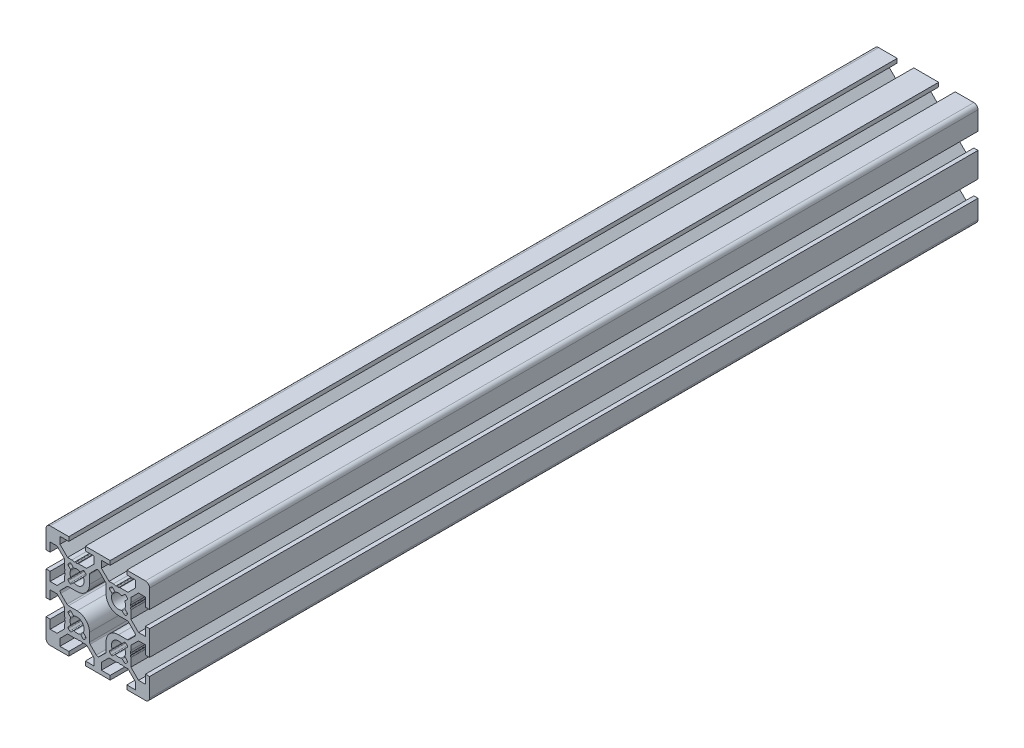
from build123d import *

# Parameters (mm, degrees)
BOSS_EXTRUDE1_DEPTH = 400
CUT_EXTRUDE1_DEPTH  = 402.559460105
CUT_EXTRUDE2_DEPTH  = 402.559460105
CUT_EXTRUDE3_DEPTH  = 402.559460105
CUT_EXTRUDE4_DEPTH  = 402.559460105


with BuildPart() as part:
    # Sketch1 → Boss-Extrude1 (new body)
    with BuildSketch(Plane.XY):
        with BuildLine():
            Line((-25, 23), (-25, 14))
            Line((-25, 14), (-23, 14))
            Line((-23, 14), (-23, 18.25))
            Line((-23, 18.25), (-19.664213562, 18.25))
            Line((-19.664213562, 18.25), (-16, 14.585786438))
            Line((-16, 14.585786438), (-16, 10.653589838))
            ThreePointArc((-16, 10.653589838), (-15.982962913, 10.524180316), (-15.933012702, 10.403589838))
            Line((-15.933012702, 10.403589838), (-15.7, 10))
            Line((-15.7, 10), (-15.933012702, 9.596410162))
            ThreePointArc((-15.933012702, 9.596410162), (-16, 9.346410162), (-15.933012702, 9.096410162))
            Line((-15.933012702, 9.096410162), (-15.750976592, 8.781114371))
            Line((-15.750976592, 8.781114371), (-16, 7.5))
            Line((-16, 7.5), (-16, 5.414213562))
            Line((-16, 5.414213562), (-19.664213562, 1.75))
            Line((-19.664213562, 1.75), (-23, 1.75))
            Line((-23, 1.75), (-23, 6))
            Line((-23, 6), (-25, 6))
            Line((-25, 6), (-25, -6))
            Line((-25, -6), (-23, -6))
            Line((-23, -6), (-23, -1.75))
            Line((-23, -1.75), (-19.664213562, -1.75))
            Line((-19.664213562, -1.75), (-16, -5.414213562))
            Line((-16, -5.414213562), (-16, -9.346410162))
            ThreePointArc((-16, -9.346410162), (-15.982962913, -9.475819684), (-15.933012702, -9.596410162))
            Line((-15.933012702, -9.596410162), (-15.7, -10))
            Line((-15.7, -10), (-15.933012702, -10.403589838))
            ThreePointArc((-15.933012702, -10.403589838), (-16, -10.653589838), (-15.933012702, -10.903589838))
            Line((-15.933012702, -10.903589838), (-15.750976592, -11.218885629))
            Line((-15.750976592, -11.218885629), (-16, -12.5))
            Line((-16, -12.5), (-16, -14.585786438))
            Line((-16, -14.585786438), (-19.664213562, -18.25))
            Line((-19.664213562, -18.25), (-23, -18.25))
            Line((-23, -18.25), (-23, -14))
            Line((-23, -14), (-25, -14))
            Line((-25, -14), (-25, -23))
            ThreePointArc((-25, -23), (-24.414213562, -24.414213562), (-23, -25))
            Line((-23, -25), (-14, -25))
            Line((-14, -25), (-14, -23))
            Line((-14, -23), (-18.25, -23))
            Line((-18.25, -23), (-18.25, -19.664213562))
            Line((-18.25, -19.664213562), (-14.585786438, -16))
            Line((-14.585786438, -16), (-10.653589838, -16))
            ThreePointArc((-10.653589838, -16), (-10.524180316, -15.982962913), (-10.403589838, -15.933012702))
            Line((-10.403589838, -15.933012702), (-10, -15.7))
            Line((-10, -15.7), (-9.596410162, -15.933012702))
            ThreePointArc((-9.596410162, -15.933012702), (-9.346410162, -16), (-9.096410162, -15.933012702))
            Line((-9.096410162, -15.933012702), (-8.781114371, -15.750976592))
            Line((-8.781114371, -15.750976592), (-7.5, -16))
            Line((-7.5, -16), (-5.414213562, -16))
            Line((-5.414213562, -16), (-1.75, -19.664213562))
            Line((-1.75, -19.664213562), (-1.75, -23))
            Line((-1.75, -23), (-6, -23))
            Line((-6, -23), (-6, -25))
            Line((-6, -25), (6, -25))
            Line((6, -25), (6, -23))
            Line((6, -23), (1.75, -23))
            Line((1.75, -23), (1.75, -19.664213562))
            Line((1.75, -19.664213562), (5.414213562, -16))
            Line((5.414213562, -16), (9.346410162, -16))
            ThreePointArc((9.346410162, -16), (9.475819684, -15.982962913), (9.596410162, -15.933012702))
            Line((9.596410162, -15.933012702), (10, -15.7))
            Line((10, -15.7), (10.403589838, -15.933012702))
            ThreePointArc((10.403589838, -15.933012702), (10.653589838, -16), (10.903589838, -15.933012702))
            Line((10.903589838, -15.933012702), (11.218885629, -15.750976592))
            Line((11.218885629, -15.750976592), (12.5, -16))
            Line((12.5, -16), (14.585786438, -16))
            Line((14.585786438, -16), (18.25, -19.664213562))
            Line((18.25, -19.664213562), (18.25, -23))
            Line((18.25, -23), (14, -23))
            Line((14, -23), (14, -25))
            Line((14, -25), (23, -25))
            ThreePointArc((23, -25), (24.414213562, -24.414213562), (25, -23))
            Line((25, -23), (25, -14))
            Line((25, -14), (23, -14))
            Line((23, -14), (23, -18.25))
            Line((23, -18.25), (19.664213562, -18.25))
            Line((19.664213562, -18.25), (16, -14.585786438))
            Line((16, -14.585786438), (16, -10.653589838))
            ThreePointArc((16, -10.653589838), (15.982962913, -10.524180316), (15.933012702, -10.403589838))
            Line((15.933012702, -10.403589838), (15.7, -10))
            Line((15.7, -10), (15.933012702, -9.596410162))
            ThreePointArc((15.933012702, -9.596410162), (16, -9.346410162), (15.933012702, -9.096410162))
            Line((15.933012702, -9.096410162), (15.750976592, -8.781114371))
            Line((15.750976592, -8.781114371), (16, -7.5))
            Line((16, -7.5), (16, -5.414213562))
            Line((16, -5.414213562), (19.664213562, -1.75))
            Line((19.664213562, -1.75), (23, -1.75))
            Line((23, -1.75), (23, -6))
            Line((23, -6), (25, -6))
            Line((25, -6), (25, 6))
            Line((25, 6), (23, 6))
            Line((23, 6), (23, 1.75))
            Line((23, 1.75), (19.664213562, 1.75))
            Line((19.664213562, 1.75), (16, 5.414213562))
            Line((16, 5.414213562), (16, 9.346410162))
            ThreePointArc((16, 9.346410162), (15.982962913, 9.475819684), (15.933012702, 9.596410162))
            Line((15.933012702, 9.596410162), (15.7, 10))
            Line((15.7, 10), (15.933012702, 10.403589838))
            ThreePointArc((15.933012702, 10.403589838), (16, 10.653589838), (15.933012702, 10.903589838))
            Line((15.933012702, 10.903589838), (15.750976592, 11.218885629))
            Line((15.750976592, 11.218885629), (16, 12.5))
            Line((16, 12.5), (16, 14.585786438))
            Line((16, 14.585786438), (19.664213562, 18.25))
            Line((19.664213562, 18.25), (23, 18.25))
            Line((23, 18.25), (23, 14))
            Line((23, 14), (25, 14))
            Line((25, 14), (25, 23))
            ThreePointArc((25, 23), (24.414213562, 24.414213562), (23, 25))
            Line((23, 25), (14, 25))
            Line((14, 25), (14, 23))
            Line((14, 23), (18.25, 23))
            Line((18.25, 23), (18.25, 19.664213562))
            Line((18.25, 19.664213562), (14.585786438, 16))
            Line((14.585786438, 16), (10.653589838, 16))
            ThreePointArc((10.653589838, 16), (10.524180316, 15.982962913), (10.403589838, 15.933012702))
            Line((10.403589838, 15.933012702), (10, 15.7))
            Line((10, 15.7), (9.596410162, 15.933012702))
            ThreePointArc((9.596410162, 15.933012702), (9.346410162, 16), (9.096410162, 15.933012702))
            Line((9.096410162, 15.933012702), (8.781114371, 15.750976592))
            Line((8.781114371, 15.750976592), (7.5, 16))
            Line((7.5, 16), (5.414213562, 16))
            Line((5.414213562, 16), (1.75, 19.664213562))
            Line((1.75, 19.664213562), (1.75, 23))
            Line((1.75, 23), (6, 23))
            Line((6, 23), (6, 25))
            Line((6, 25), (-6, 25))
            Line((-6, 25), (-6, 23))
            Line((-6, 23), (-1.75, 23))
            Line((-1.75, 23), (-1.75, 19.664213562))
            Line((-1.75, 19.664213562), (-5.414213562, 16))
            Line((-5.414213562, 16), (-9.346410162, 16))
            ThreePointArc((-9.346410162, 16), (-9.475819684, 15.982962913), (-9.596410162, 15.933012702))
            Line((-9.596410162, 15.933012702), (-10, 15.7))
            Line((-10, 15.7), (-10.403589838, 15.933012702))
            ThreePointArc((-10.403589838, 15.933012702), (-10.653589838, 16), (-10.903589838, 15.933012702))
            Line((-10.903589838, 15.933012702), (-11.218885629, 15.750976592))
            Line((-11.218885629, 15.750976592), (-12.5, 16))
            Line((-12.5, 16), (-14.585786438, 16))
            Line((-14.585786438, 16), (-18.25, 19.664213562))
            Line((-18.25, 19.664213562), (-18.25, 23))
            Line((-18.25, 23), (-14, 23))
            Line((-14, 23), (-14, 25))
            Line((-14, 25), (-23, 25))
            ThreePointArc((-23, 25), (-24.414213562, 24.414213562), (-25, 23))
        make_face()
        with BuildLine():
            Line((-17.878679656, -0.707106781), (-14.878679656, -3.707106781))
            ThreePointArc((-14.878679656, -3.707106781), (-14.554256308, -3.923879533), (-14.171572875, -4))
            Line((-14.171572875, -4), (-10, -4))
            ThreePointArc((-10, -4), (-5.757359313, -5.757359313), (-4, -10))
            Line((-4, -10), (-4, -14.171572875))
            ThreePointArc((-4, -14.171572875), (-3.923879533, -14.554256308), (-3.707106781, -14.878679656))
            Line((-3.707106781, -14.878679656), (-0.707106781, -17.878679656))
            ThreePointArc((-0.707106781, -17.878679656), (0, -18.171572875), (0.707106781, -17.878679656))
            Line((0.707106781, -17.878679656), (3.707106781, -14.878679656))
            ThreePointArc((3.707106781, -14.878679656), (3.923879533, -14.554256308), (4, -14.171572875))
            Line((4, -14.171572875), (4, -10))
            ThreePointArc((4, -10), (5.757359313, -5.757359313), (10, -4))
            Line((10, -4), (14.171572875, -4))
            ThreePointArc((14.171572875, -4), (14.554256308, -3.923879533), (14.878679656, -3.707106781))
            Line((14.878679656, -3.707106781), (17.878679656, -0.707106781))
            ThreePointArc((17.878679656, -0.707106781), (18.171572875, 0), (17.878679656, 0.707106781))
            Line((17.878679656, 0.707106781), (14.878679656, 3.707106781))
            ThreePointArc((14.878679656, 3.707106781), (14.554256308, 3.923879533), (14.171572875, 4))
            Line((14.171572875, 4), (10, 4))
            ThreePointArc((10, 4), (5.757359313, 5.757359313), (4, 10))
            Line((4, 10), (4, 14.171572875))
            ThreePointArc((4, 14.171572875), (3.923879533, 14.554256308), (3.707106781, 14.878679656))
            Line((3.707106781, 14.878679656), (0.707106781, 17.878679656))
            ThreePointArc((0.707106781, 17.878679656), (0, 18.171572875), (-0.707106781, 17.878679656))
            Line((-0.707106781, 17.878679656), (-3.707106781, 14.878679656))
            ThreePointArc((-3.707106781, 14.878679656), (-3.923879533, 14.554256308), (-4, 14.171572875))
            Line((-4, 14.171572875), (-4, 10))
            ThreePointArc((-4, 10), (-5.757359313, 5.757359313), (-10, 4))
            Line((-10, 4), (-14.171572875, 4))
            ThreePointArc((-14.171572875, 4), (-14.554256308, 3.923879533), (-14.878679656, 3.707106781))
            Line((-14.878679656, 3.707106781), (-17.878679656, 0.707106781))
            ThreePointArc((-17.878679656, 0.707106781), (-18.171572875, 0), (-17.878679656, -0.707106781))
        make_face(mode=Mode.SUBTRACT)
    extrude(amount=-BOSS_EXTRUDE1_DEPTH)

    # Sketch2 → Cut-Extrude1 (cut, through all)
    with BuildSketch(Plane.XY):
        with BuildLine():
            Line((-14.242640687, 12.828427125), (-13.205105981, 11.790892418))
            ThreePointArc((-13.205105981, 11.790892418), (-13.095045749, 11.583064884), (-13.120796199, 11.349307631))
            ThreePointArc((-13.120796199, 11.349307631), (-13.4, 10.000000021), (-13.120796216, 8.650692407))
            ThreePointArc((-13.120796216, 8.650692407), (-13.095045745, 8.416935137), (-13.205105981, 8.209107582))
            Line((-13.205105981, 8.209107582), (-14.242640687, 7.171572875))
            ThreePointArc((-14.242640687, 7.171572875), (-14.389087297, 6.818019485), (-14.242640687, 6.464466094))
            Line((-14.242640687, 6.464466094), (-13.535533906, 5.757359313))
            ThreePointArc((-13.535533906, 5.757359313), (-13.181980515, 5.610912703), (-12.828427125, 5.757359313))
            Line((-12.828427125, 5.757359313), (-11.790892418, 6.794894019))
            ThreePointArc((-11.790892418, 6.794894019), (-11.583064884, 6.904954251), (-11.349307631, 6.879203801))
            ThreePointArc((-11.349307631, 6.879203801), (-7.595836944, 7.595836944), (-6.879203801, 11.349307631))
            ThreePointArc((-6.879203801, 11.349307631), (-6.904954251, 11.583064884), (-6.794894019, 11.790892418))
            Line((-6.794894019, 11.790892418), (-5.757359313, 12.828427125))
            ThreePointArc((-5.757359313, 12.828427125), (-5.610912703, 13.181980515), (-5.757359313, 13.535533906))
            Line((-5.757359313, 13.535533906), (-6.464466094, 14.242640687))
            ThreePointArc((-6.464466094, 14.242640687), (-6.818019485, 14.389087297), (-7.171572875, 14.242640687))
            Line((-7.171572875, 14.242640687), (-8.209107582, 13.205105981))
            ThreePointArc((-8.209107582, 13.205105981), (-8.416935116, 13.095045749), (-8.650692369, 13.120796199))
            ThreePointArc((-8.650692369, 13.120796199), (-9.999999979, 13.4), (-11.349307593, 13.120796216))
            ThreePointArc((-11.349307593, 13.120796216), (-11.583064863, 13.095045745), (-11.790892418, 13.205105981))
            Line((-11.790892418, 13.205105981), (-12.828427125, 14.242640687))
            ThreePointArc((-12.828427125, 14.242640687), (-13.181980515, 14.389087297), (-13.535533906, 14.242640687))
            Line((-13.535533906, 14.242640687), (-14.242640687, 13.535533906))
            ThreePointArc((-14.242640687, 13.535533906), (-14.389087297, 13.181980515), (-14.242640687, 12.828427125))
        make_face()
    extrude(amount=-CUT_EXTRUDE1_DEPTH, mode=Mode.SUBTRACT)

    # Sketch3 → Cut-Extrude2 (cut, through all)
    with BuildSketch(Plane.XY):
        with BuildLine():
            Line((-12.828427125, -14.242640687), (-11.790892418, -13.205105981))
            ThreePointArc((-11.790892418, -13.205105981), (-11.583064884, -13.095045749), (-11.349307631, -13.120796199))
            ThreePointArc((-11.349307631, -13.120796199), (-10.000000021, -13.4), (-8.650692407, -13.120796216))
            ThreePointArc((-8.650692407, -13.120796216), (-8.416935137, -13.095045745), (-8.209107582, -13.205105981))
            Line((-8.209107582, -13.205105981), (-7.171572875, -14.242640687))
            ThreePointArc((-7.171572875, -14.242640687), (-6.818019485, -14.389087297), (-6.464466094, -14.242640687))
            Line((-6.464466094, -14.242640687), (-5.757359313, -13.535533906))
            ThreePointArc((-5.757359313, -13.535533906), (-5.610912703, -13.181980515), (-5.757359313, -12.828427125))
            Line((-5.757359313, -12.828427125), (-6.794894019, -11.790892418))
            ThreePointArc((-6.794894019, -11.790892418), (-6.904954251, -11.583064884), (-6.879203801, -11.349307631))
            ThreePointArc((-6.879203801, -11.349307631), (-7.595836944, -7.595836944), (-11.349307631, -6.879203801))
            ThreePointArc((-11.349307631, -6.879203801), (-11.583064884, -6.904954251), (-11.790892418, -6.794894019))
            Line((-11.790892418, -6.794894019), (-12.828427125, -5.757359313))
            ThreePointArc((-12.828427125, -5.757359313), (-13.181980515, -5.610912703), (-13.535533906, -5.757359313))
            Line((-13.535533906, -5.757359313), (-14.242640687, -6.464466094))
            ThreePointArc((-14.242640687, -6.464466094), (-14.389087297, -6.818019485), (-14.242640687, -7.171572875))
            Line((-14.242640687, -7.171572875), (-13.205105981, -8.209107582))
            ThreePointArc((-13.205105981, -8.209107582), (-13.095045749, -8.416935116), (-13.120796199, -8.650692369))
            ThreePointArc((-13.120796199, -8.650692369), (-13.4, -9.999999979), (-13.120796216, -11.349307593))
            ThreePointArc((-13.120796216, -11.349307593), (-13.095045745, -11.583064863), (-13.205105981, -11.790892418))
            Line((-13.205105981, -11.790892418), (-14.242640687, -12.828427125))
            ThreePointArc((-14.242640687, -12.828427125), (-14.389087297, -13.181980515), (-14.242640687, -13.535533906))
            Line((-14.242640687, -13.535533906), (-13.535533906, -14.242640687))
            ThreePointArc((-13.535533906, -14.242640687), (-13.181980515, -14.389087297), (-12.828427125, -14.242640687))
        make_face()
    extrude(amount=-CUT_EXTRUDE2_DEPTH, mode=Mode.SUBTRACT)

    # Sketch4 → Cut-Extrude3 (cut, through all)
    with BuildSketch(Plane.XY):
        with BuildLine():
            Line((14.242640687, -12.828427125), (13.205105981, -11.790892418))
            ThreePointArc((13.205105981, -11.790892418), (13.095045749, -11.583064884), (13.120796199, -11.349307631))
            ThreePointArc((13.120796199, -11.349307631), (13.4, -10.000000021), (13.120796216, -8.650692407))
            ThreePointArc((13.120796216, -8.650692407), (13.095045745, -8.416935137), (13.205105981, -8.209107582))
            Line((13.205105981, -8.209107582), (14.242640687, -7.171572875))
            ThreePointArc((14.242640687, -7.171572875), (14.389087297, -6.818019485), (14.242640687, -6.464466094))
            Line((14.242640687, -6.464466094), (13.535533906, -5.757359313))
            ThreePointArc((13.535533906, -5.757359313), (13.181980515, -5.610912703), (12.828427125, -5.757359313))
            Line((12.828427125, -5.757359313), (11.790892418, -6.794894019))
            ThreePointArc((11.790892418, -6.794894019), (11.583064884, -6.904954251), (11.349307631, -6.879203801))
            ThreePointArc((11.349307631, -6.879203801), (7.595836944, -7.595836944), (6.879203801, -11.349307631))
            ThreePointArc((6.879203801, -11.349307631), (6.904954251, -11.583064884), (6.794894019, -11.790892418))
            Line((6.794894019, -11.790892418), (5.757359313, -12.828427125))
            ThreePointArc((5.757359313, -12.828427125), (5.610912703, -13.181980515), (5.757359313, -13.535533906))
            Line((5.757359313, -13.535533906), (6.464466094, -14.242640687))
            ThreePointArc((6.464466094, -14.242640687), (6.818019485, -14.389087297), (7.171572875, -14.242640687))
            Line((7.171572875, -14.242640687), (8.209107582, -13.205105981))
            ThreePointArc((8.209107582, -13.205105981), (8.416935116, -13.095045749), (8.650692369, -13.120796199))
            ThreePointArc((8.650692369, -13.120796199), (9.999999979, -13.4), (11.349307593, -13.120796216))
            ThreePointArc((11.349307593, -13.120796216), (11.583064863, -13.095045745), (11.790892418, -13.205105981))
            Line((11.790892418, -13.205105981), (12.828427125, -14.242640687))
            ThreePointArc((12.828427125, -14.242640687), (13.181980515, -14.389087297), (13.535533906, -14.242640687))
            Line((13.535533906, -14.242640687), (14.242640687, -13.535533906))
            ThreePointArc((14.242640687, -13.535533906), (14.389087297, -13.181980515), (14.242640687, -12.828427125))
        make_face()
    extrude(amount=-CUT_EXTRUDE3_DEPTH, mode=Mode.SUBTRACT)

    # Sketch5 → Cut-Extrude4 (cut, through all)
    with BuildSketch(Plane.XY):
        with BuildLine():
            Line((12.828427125, 14.242640687), (11.790892418, 13.205105981))
            ThreePointArc((11.790892418, 13.205105981), (11.583064884, 13.095045749), (11.349307631, 13.120796199))
            ThreePointArc((11.349307631, 13.120796199), (10.000000021, 13.4), (8.650692407, 13.120796216))
            ThreePointArc((8.650692407, 13.120796216), (8.416935137, 13.095045745), (8.209107582, 13.205105981))
            Line((8.209107582, 13.205105981), (7.171572875, 14.242640687))
            ThreePointArc((7.171572875, 14.242640687), (6.818019485, 14.389087297), (6.464466094, 14.242640687))
            Line((6.464466094, 14.242640687), (5.757359313, 13.535533906))
            ThreePointArc((5.757359313, 13.535533906), (5.610912703, 13.181980515), (5.757359313, 12.828427125))
            Line((5.757359313, 12.828427125), (6.794894019, 11.790892418))
            ThreePointArc((6.794894019, 11.790892418), (6.904954251, 11.583064884), (6.879203801, 11.349307631))
            ThreePointArc((6.879203801, 11.349307631), (7.595836944, 7.595836944), (11.349307631, 6.879203801))
            ThreePointArc((11.349307631, 6.879203801), (11.583064884, 6.904954251), (11.790892418, 6.794894019))
            Line((11.790892418, 6.794894019), (12.828427125, 5.757359313))
            ThreePointArc((12.828427125, 5.757359313), (13.181980515, 5.610912703), (13.535533906, 5.757359313))
            Line((13.535533906, 5.757359313), (14.242640687, 6.464466094))
            ThreePointArc((14.242640687, 6.464466094), (14.389087297, 6.818019485), (14.242640687, 7.171572875))
            Line((14.242640687, 7.171572875), (13.205105981, 8.209107582))
            ThreePointArc((13.205105981, 8.209107582), (13.095045749, 8.416935116), (13.120796199, 8.650692369))
            ThreePointArc((13.120796199, 8.650692369), (13.4, 9.999999979), (13.120796216, 11.349307593))
            ThreePointArc((13.120796216, 11.349307593), (13.095045745, 11.583064863), (13.205105981, 11.790892418))
            Line((13.205105981, 11.790892418), (14.242640687, 12.828427125))
            ThreePointArc((14.242640687, 12.828427125), (14.389087297, 13.181980515), (14.242640687, 13.535533906))
            Line((14.242640687, 13.535533906), (13.535533906, 14.242640687))
            ThreePointArc((13.535533906, 14.242640687), (13.181980515, 14.389087297), (12.828427125, 14.242640687))
        make_face()
    extrude(amount=-CUT_EXTRUDE4_DEPTH, mode=Mode.SUBTRACT)


solid = part.part
